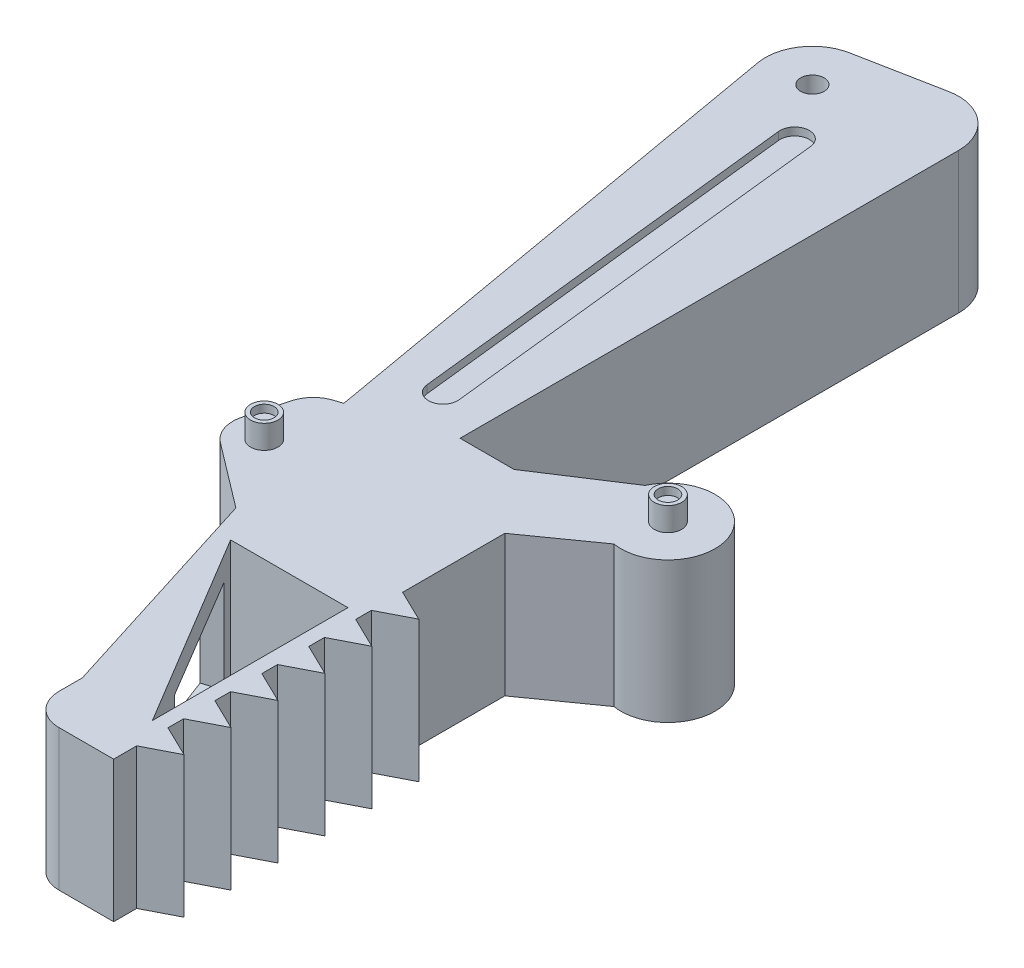
from build123d import *

# Parameters (mm, degrees)
BOSS_EXTRUDE1_DEPTH = 9
FILLET1_R           = 6
FILLET2_R           = 4
BOSS_EXTRUDE2_DEPTH = 18
LPATTERN1_COUNT     = 6
LPATTERN1_PITCH     = 6
CUT_EXTRUDE1_DEPTH  = 149.120803233
CUT_EXTRUDE2_DEPTH  = 8
SKETCH6_R           = 1.5
CUT_EXTRUDE3_DEPTH  = 149.120803233
SKETCH7_R           = 1.75
BOSS_EXTRUDE3_DEPTH = 3
SKETCH9_R           = 1.25
CUT_EXTRUDE4_DEPTH  = 1
SKETCH10_R          = 1.25
CUT_EXTRUDE5_DEPTH  = 1
CUT_EXTRUDE7_DEPTH  = 1


with BuildPart() as part:
    # Sketch2 → Boss-Extrude1 (new, symmetric)
    with BuildSketch(Plane(origin=(0, 0, 0), x_dir=(1, 0, 0), z_dir=(0, 1, 0))):
        with BuildLine():
            Line((-39.563995826, -83.832935468), (-42.630019208, -84.799815256))
            Line((-42.630019208, -84.799815256), (-45.240501853, -94.451735935))
            Line((-45.240501853, -94.451735935), (-34.884360154, -102.309873698))
            Line((-34.884360154, -102.309873698), (-25.888982114, -130.929502869))
            Line((-25.888982114, -130.929502869), (-25.888982114, -137.929502869))
            Line((-25.888982114, -137.929502869), (-14.888982114, -137.929502869))
            Line((-14.888982114, -137.929502869), (-14.888982114, -87.929502869))
            Line((-14.888982114, -87.929502869), (-6.735604792, -82.139646373))
            ThreePointArc((-6.735604792, -82.139646373), (-0.446003435, -73.378982845), (-11.226689216, -73.670744316))
            Line((-11.226689216, -73.670744316), (-21.363708344, -80.271037279))
            Line((-21.363708344, -80.271037279), (-28.269041415, -80.271037279))
            Line((-28.269041415, -80.271037279), (-28.269041415, -9.271037279))
            Line((-28.269041415, -9.271037279), (-51.831492155, -13.832935468))
            Line((-51.831492155, -13.832935468), (-39.563995826, -83.832935468))
        make_face()
    extrude(amount=BOSS_EXTRUDE1_DEPTH, both=True)

    # Fillet1
    fillet1_edges = [part.edges().sort_by_distance(p)[0] for p in [
        (-51.831492155, 0, 13.832935468),
        (-28.269041415, 0, 9.271037279),
    ]]
    fillet(fillet1_edges, radius=FILLET1_R)

    # Fillet2
    fillet2_edges = [part.edges().sort_by_distance(p)[0] for p in [
        (-42.630019208, 0, 84.799815256),
        (-25.888982114, 0, 137.929502869),
        (-45.240501853, 0, 94.451735935),
    ]]
    fillet(fillet2_edges, radius=FILLET2_R)

    # Sketch3 → Boss-Extrude2 (add)
    with BuildSketch(Plane(origin=(0, 9, 0), x_dir=(1, 0, 0), z_dir=(0, 1, 0))):
        Polygon((-14.888982114, -130.986597937), (-14.888982114, -134.986597937), (-10.884332588, -132.931354664), align=None)
    boss_extrude2 = extrude(amount=-BOSS_EXTRUDE2_DEPTH)

    # LPattern1: Boss-Extrude2 ×6
    with Locations(*[(0, 0, -i * LPATTERN1_PITCH) for i in range(1, LPATTERN1_COUNT)]):
        add(boss_extrude2)

    # Sketch4 → Cut-Extrude1 (cut, through all)
    with BuildSketch(Plane(origin=(0, 9, 0), x_dir=(1, 0, 0), z_dir=(0, 1, 0))):
        Polygon((-16.683079676, -131.183487283), (-16.683079676, -106.183487283), (-31.683079676, -106.183487283), align=None)
    extrude(amount=-CUT_EXTRUDE1_DEPTH, mode=Mode.SUBTRACT)

    # Sketch5 → Cut-Extrude2 (cut)
    with BuildSketch(Plane(origin=(-61.013660914, 0, 19.177080956), x_dir=(0.29984593468383275, 0, 0.9539876390465334), z_dir=(-0.9539876390465333, 0, 0.2998459346838327))):
        Polygon((94.142421284, 6), (94.142421284, -6), (112.142421284, -7.790586592), (112.142421284, 6.177981397), align=None)
    extrude(amount=-CUT_EXTRUDE2_DEPTH, mode=Mode.SUBTRACT)

    # Sketch6 → Cut-Extrude3 (cut, through all)
    with BuildSketch(Plane(origin=(0, 9, 0), x_dir=(1, 0, 0), z_dir=(0, 1, 0))):
        with Locations(Location((-44.904072418, -18.603144546, 0), (0, 0, 270))):
            Circle(SKETCH6_R)
    extrude(amount=-CUT_EXTRUDE3_DEPTH, mode=Mode.SUBTRACT)

    # Sketch7 → Boss-Extrude3 (add)
    with BuildSketch(Plane(origin=(0, 9, 0), x_dir=(1, 0, 0), z_dir=(0, 1, 0))):
        with Locations(Location((-40.67557748, -92.894380322, 0), (0, 0, 90))):
            Circle(SKETCH7_R)
        with Locations(Location((-5.76397205, -76.199117717, 0), (0, 0, 90))):
            Circle(SKETCH7_R)
    boss_extrude3 = extrude(amount=BOSS_EXTRUDE3_DEPTH)

    # Sketch9 → Cut-Extrude4 (cut)
    with BuildSketch(Plane(origin=(0, 12, 0), x_dir=(1, 0, 0), z_dir=(0, 1, 0))):
        with Locations(Location((-40.67557748, -92.894380322, 0), (0, 0, 270))):
            Circle(SKETCH9_R)
    cut_extrude4 = extrude(amount=-CUT_EXTRUDE4_DEPTH, mode=Mode.SUBTRACT)

    # Sketch10 → Cut-Extrude5 (cut)
    with BuildSketch(Plane(origin=(0, 12, 0), x_dir=(1, 0, 0), z_dir=(0, 1, 0))):
        with Locations(Location((-5.76397205, -76.199117717, 0), (0, 0, 270))):
            Circle(SKETCH10_R)
    cut_extrude5 = extrude(amount=-CUT_EXTRUDE5_DEPTH, mode=Mode.SUBTRACT)

    # Sketch11 → Cut-Extrude7 (cut)
    with BuildSketch(Plane(origin=(0, 9, 0), x_dir=(1, 0, 0), z_dir=(0, 1, 0))):
        with BuildLine():
            Line((-38.170562816, -25.535404597), (-32.594288437, -76.059830025))
            ThreePointArc((-32.594288437, -76.059830025), (-34.244390745, -78.119356213), (-36.303916933, -76.469253906))
            Line((-36.303916933, -76.469253906), (-41.880191311, -25.944828478))
            ThreePointArc((-41.880191311, -25.944828478), (-40.230089004, -23.88530229), (-38.170562816, -25.535404597))
        make_face()
    cut_extrude7 = extrude(amount=-CUT_EXTRUDE7_DEPTH, mode=Mode.SUBTRACT)

    # Mirror1: Boss-Extrude3, Cut-Extrude4, Cut-Extrude5, Cut-Extrude7 across plane
    add(boss_extrude3.mirror(Plane.ZX))
    add(cut_extrude4.mirror(Plane.ZX), mode=Mode.SUBTRACT)
    add(cut_extrude5.mirror(Plane.ZX), mode=Mode.SUBTRACT)
    add(cut_extrude7.mirror(Plane.ZX), mode=Mode.SUBTRACT)


solid = part.part
